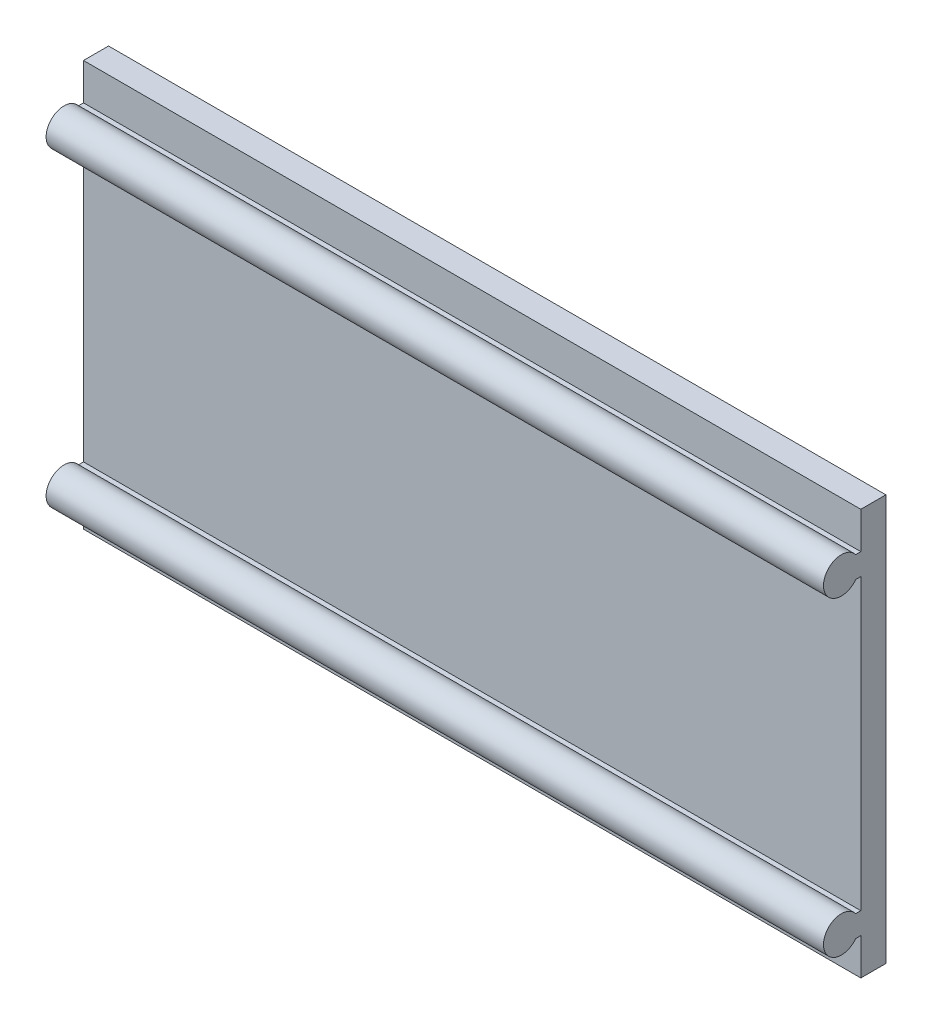
from build123d import *

# Parameters (mm, degrees)
EXTRUDE_1_DEPTH             = 90
SKETCH_2_W                  = 90
SKETCH_2_H                  = 17.75
EXTRUDE_2_DEPTH             = 8.2
SKETCH_3_W                  = 90
SKETCH_3_H                  = 50.95
EXTRUDE_3_DEPTH             = 8.2
SKETCH_4_W                  = 3.95
SKETCH_4_H                  = 29.5
CUT_EXTRUDE_1_DEPTH         = 96.44153315
SKETCH_5_W                  = 3.95
SKETCH_5_H                  = 6.2
CUT_EXTRUDE_2_DEPTH         = 96.44153315
SKETCH_6_W                  = 2.25
SKETCH_6_H                  = 3.95
CUT_EXTRUDE_3_DEPTH         = 96.44153315
SKETCH_7_W                  = 4.5
SKETCH_7_H                  = 3.95
CUT_EXTRUDE_4_DEPTH         = 96.44153315
SKETCH_8_W                  = 2.25
SKETCH_8_H                  = 3.95
CUT_EXTRUDE_5_DEPTH         = 96.44153315
SKETCH_9_W                  = 3.95
SKETCH_9_H                  = 2.25
CUT_EXTRUDE_6_DEPTH         = 96.44153315
SKETCH_10_W                 = 20.2
SKETCH_10_H                 = 45.2
CUT_EXTRUDE_7_DEPTH         = 86
HOLE_WIZARD_2_5_2_5_1_D     = 2.5
HOLE_WIZARD_4_5_4_5_1_D     = 4.5
HOLE_WIZARD_8_3_8_3_1_D     = 8.3
HOLE_WIZARD_8_3_8_3_1_DEPTH = 3.2
FILLET_1_R                  = 2
FILLET_2_R                  = 2
EXTRUDE_START               = -90
SKETCH_17_R                 = 1.25
EXTRUDE_4_DEPTH             = 90
CUT_EXTRUDE_START           = -100
SKETCH_18_R                 = 4.15
CUT_EXTRUDE_8_DEPTH         = 100
CUT_EXTRUDE_11_DEPTH        = 108
CUT_EXTRUDE_12_DEPTH        = 108
SKETCH_21_W                 = 90
SKETCH_21_H                 = 47
EXTRUDE_5_DEPTH             = 2


with BuildPart() as part:
    # Эскиз1 → Бобышка-Вытянуть1 (new body)
    with BuildSketch(Plane(origin=(90, 0, 0), x_dir=(0, 0, -1), z_dir=(1, 0, 0))):
        with BuildLine():
            Line((6.75, -24.093761792), (6.75, 19.25))
            Line((6.75, 19.25), (-11.593761792, 19.25))
            ThreePointArc((-11.593761792, 19.25), (-15.325, 18), (-11.593761792, 16.75))
            Line((-11.593761792, 16.75), (-11, 16.75))
            Line((-11, 16.75), (-11, -16.75))
            Line((-11, -16.75), (-11.593761792, -16.75))
            ThreePointArc((-11.593761792, -16.75), (-15.325, -18), (-11.593761792, -19.25))
            Line((-11.593761792, -19.25), (-11, -19.25))
            Line((-11, -19.25), (-11, -23.5))
            Line((-11, -23.5), (-6.75, -23.5))
            Line((-6.75, -23.5), (-6.75, -24.093761792))
            ThreePointArc((-6.75, -24.093761792), (-5.5, -27.825), (-4.25, -24.093761792))
            Line((-4.25, -24.093761792), (-4.25, -23.5))
            Line((-4.25, -23.5), (4.25, -23.5))
            Line((4.25, -23.5), (4.25, -24.093761792))
            ThreePointArc((4.25, -24.093761792), (5.5, -27.825), (6.75, -24.093761792))
        make_face()
    extrude(amount=-EXTRUDE_1_DEPTH)

    # Эскиз2 → Бобышка-Вытянуть2 (add)
    with BuildSketch(Plane(origin=(0, 19.25, 0), x_dir=(-1, 0, 0), z_dir=(0, 1, 0))):
        with Locations((-45, 2.125)):
            Rectangle(SKETCH_2_W, SKETCH_2_H)
    extrude(amount=EXTRUDE_2_DEPTH)

    # Эскиз3 → Бобышка-Вытянуть3 (add)
    with BuildSketch(Plane(origin=(0, 0, -6.75), x_dir=(-1, 0, 0), z_dir=(0, 0, -1))):
        with Locations((-45, 1.975)):
            Rectangle(SKETCH_3_W, SKETCH_3_H)
    extrude(amount=EXTRUDE_3_DEPTH)

    # Эскиз4 → Вырез-Вытянуть1 (cut, through all)
    with BuildSketch(Plane.ZY):
        with Locations((-12.975, 0)):
            Rectangle(SKETCH_4_W, SKETCH_4_H)
    extrude(amount=-CUT_EXTRUDE_1_DEPTH, mode=Mode.SUBTRACT)

    # Эскиз5 → Вырез-Вытянуть2 (cut, through all)
    with BuildSketch(Plane.ZY):
        with Locations((-12.975, 24.35)):
            Rectangle(SKETCH_5_W, SKETCH_5_H)
    extrude(amount=-CUT_EXTRUDE_2_DEPTH, mode=Mode.SUBTRACT)

    # Эскиз6 → Вырез-Вытянуть3 (cut, through all)
    with BuildSketch(Plane.ZY):
        with Locations((-9.875, 25.475)):
            Rectangle(SKETCH_6_W, SKETCH_6_H)
    extrude(amount=-CUT_EXTRUDE_3_DEPTH, mode=Mode.SUBTRACT)

    # Эскиз7 → Вырез-Вытянуть4 (cut, through all)
    with BuildSketch(Plane.ZY):
        with Locations((0, 25.475)):
            Rectangle(SKETCH_7_W, SKETCH_7_H)
    extrude(amount=-CUT_EXTRUDE_4_DEPTH, mode=Mode.SUBTRACT)

    # Эскиз8 → Вырез-Вытянуть5 (cut, through all)
    with BuildSketch(Plane.ZY):
        with Locations((9.875, 25.475)):
            Rectangle(SKETCH_8_W, SKETCH_8_H)
    extrude(amount=-CUT_EXTRUDE_5_DEPTH, mode=Mode.SUBTRACT)

    # Эскиз9 → Вырез-Вытянуть6 (cut, through all)
    with BuildSketch(Plane.ZY):
        with Locations((-12.975, -22.375)):
            Rectangle(SKETCH_9_W, SKETCH_9_H)
    extrude(amount=-CUT_EXTRUDE_6_DEPTH, mode=Mode.SUBTRACT)

    # Эскиз10 → Вырез-Вытянуть7 (cut)
    with BuildSketch(Plane(origin=(90, 0, 0), x_dir=(0, 0, -1), z_dir=(1, 0, 0))):
        Rectangle(SKETCH_10_W, SKETCH_10_H)
    extrude(amount=-CUT_EXTRUDE_7_DEPTH, mode=Mode.SUBTRACT)

    # Диаметр отверстия Ø2.5 (2.5)1 (through all)
    with Locations(Plane(origin=(90, 0, 0), x_dir=(0, 0, -1), z_dir=(1, 0, 0))):
        with Locations((5.5, -25.75), (-13.25, -18), (-5.5, -25.75), (-13.25, 18)):
            Hole(HOLE_WIZARD_2_5_2_5_1_D / 2)

    # Диаметр отверстия Ø4.5 (4.5)1 (through all)
    with Locations(Plane.ZY):
        with Locations((-13.25, -18), (-13.25, 18), (-5.5, 25.75), (5.5, 25.75)):
            Hole(HOLE_WIZARD_4_5_4_5_1_D / 2)

    # Диаметр отверстия Ø8.3 (8.3)1
    with Locations(Plane.ZY):
        with Locations((0, 0)):
            Hole(HOLE_WIZARD_8_3_8_3_1_D / 2, depth=HOLE_WIZARD_8_3_8_3_1_DEPTH)

    # Скругление1
    fillet_1_edges = [part.edges().sort_by_distance(p)[0] for p in [
        (45, 23.5, 8.75),
    ]]
    fillet(fillet_1_edges, radius=FILLET_1_R)

    # Скругление2
    fillet_2_edges = [part.edges().sort_by_distance(p)[0] for p in [
        (45, 23.5, -8.75),
        (45, 23.5, 2.25),
        (45, 23.5, -2.25),
        (45, -21.25, -11),
        (4, 0, -10.1),
        (4, -22.6, 0),
        (4, 0, 10.1),
        (4, 22.6, 0),
        (45, 14.75, -11),
        (45, -14.75, -11),
        (45, 21.25, -11),
    ]]
    fillet(fillet_2_edges, radius=FILLET_2_R)

    # Эскиз17 → Бобышка-Вытянуть4 (add)
    with BuildSketch(Plane(origin=(90, 0, 0), x_dir=(0, 0, -1), z_dir=(1, 0, 0)).offset(EXTRUDE_START)):
        with Locations((5.5, -25.75)):
            Circle(SKETCH_17_R)
        with Locations((-5.5, -25.75)):
            Circle(SKETCH_17_R)
        with Locations((-13.25, -18)):
            Circle(SKETCH_17_R)
        with Locations((-13.25, 18)):
            Circle(SKETCH_17_R)
    extrude(amount=EXTRUDE_4_DEPTH)

    # Эскиз18 → Вырез-Вытянуть8 (cut)
    with BuildSketch(Plane.ZY.offset(CUT_EXTRUDE_START)):
        Circle(SKETCH_18_R)
    extrude(amount=CUT_EXTRUDE_8_DEPTH, mode=Mode.SUBTRACT)

    # Эскиз19 → Вырез-Вытянуть11 (cut)
    with BuildSketch(Plane(origin=(90, 0, 0), x_dir=(0, 0, -1), z_dir=(1, 0, 0))):
        Polygon((-10.1, -22.6), (-10.1, 22.6), (-10.1, 31.781046402), (18.117629079, 31.781046402), (18.667008159, -30.769686003), (-10.1, -30.769686003), align=None)
    extrude(amount=-CUT_EXTRUDE_11_DEPTH, mode=Mode.SUBTRACT)

    # Эскиз20 → Вырез-Вытянуть12 (cut)
    with BuildSketch(Plane(origin=(90, 0, 0), x_dir=(0, 0, -1), z_dir=(1, 0, 0))):
        with BuildLine():
            Line((-10.75, 23.5), (-10.1, 23.5))
            Line((-10.1, 23.5), (-10.1, 23.608571968))
            ThreePointArc((-10.1, 23.608571968), (-10.420497393, 23.52732972), (-10.75, 23.5))
        make_face()
    extrude(amount=-CUT_EXTRUDE_12_DEPTH, mode=Mode.SUBTRACT)

    # Эскиз21 → Бобышка-Вытянуть5 (add)
    with BuildSketch(Plane(origin=(0, 0, 10.1), x_dir=(-1, 0, 0), z_dir=(0, 0, -1))):
        with Locations((-45, 0)):
            Rectangle(SKETCH_21_W, SKETCH_21_H)
    extrude(amount=EXTRUDE_5_DEPTH)


solid = part.part
